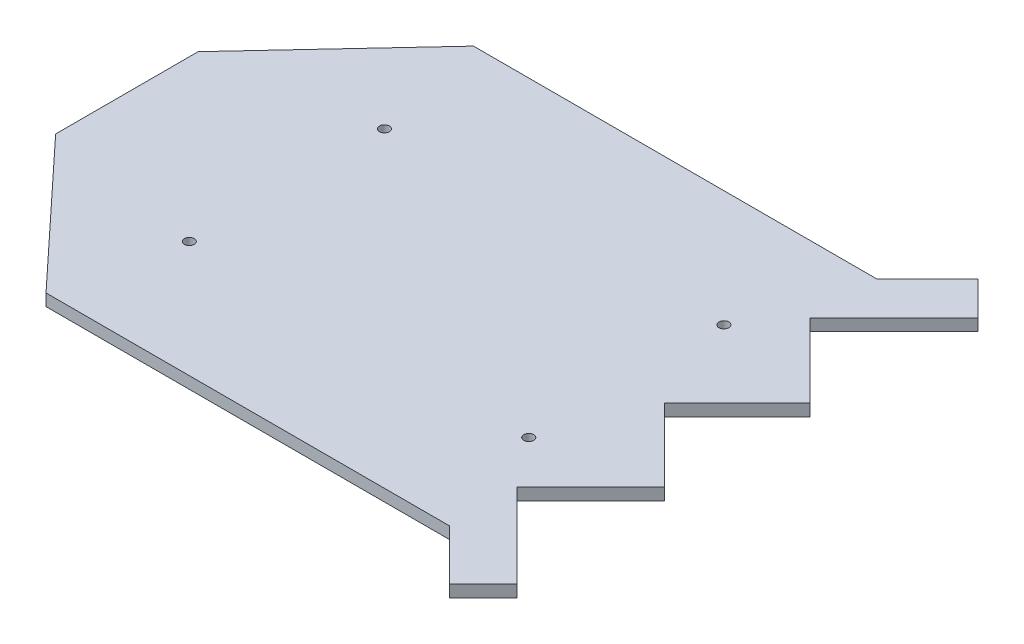
from build123d import *

# Parameters (mm, degrees)
BOSS_EXTRUDE1_DEPTH = 5
SKETCH2_R           = 2.1
CUT_EXTRUDE1_DEPTH  = 5
SKETCH5_R           = 2.1
CUT_EXTRUDE4_DEPTH  = 10


with BuildPart() as part:
    # Sketch1 → Boss-Extrude1 (new body)
    with BuildSketch(Plane(origin=(0, 0, 0), x_dir=(1, 0, 0), z_dir=(0, 1, 0))):
        Polygon((0, 30), (0, -30), (55.94, -90), (225.94, -90), (247.153203436, -111.213203436), (261.295339059, -97.071067812), (225.94, -61.715728753), (256.965728753, -30.69), (226.32179728, 0), (256.965728753, 30.69), (225.94, 61.715728753), (261.295339059, 97.071067812), (247.153203436, 111.213203436), (225.94, 90), (55.94, 90), align=None)
    extrude(amount=BOSS_EXTRUDE1_DEPTH)

    # Sketch2 → Cut-Extrude1 (cut)
    with BuildSketch(Plane(origin=(0, 5, 0), x_dir=(1, 0, 0), z_dir=(0, 1, 0))):
        with Locations(Location((210.29, 41.08, 0), (0, 0, 270))):
            Circle(SKETCH2_R)
        with Locations(Location((210.29, -41.08, 0), (0, 0, 90))):
            Circle(SKETCH2_R)
    extrude(amount=-CUT_EXTRUDE1_DEPTH, mode=Mode.SUBTRACT)

    # Sketch5 → Cut-Extrude4 (cut)
    with BuildSketch(Plane(origin=(0, 5, 0), x_dir=(1, 0, 0), z_dir=(0, 1, 0))):
        with Locations(Location((67.37, 41.08, 0), (0, 0, 270))):
            Circle(SKETCH5_R)
        with Locations(Location((67.36, -41.08, 0), (0, 0, 270))):
            Circle(SKETCH5_R)
    extrude(amount=-CUT_EXTRUDE4_DEPTH, mode=Mode.SUBTRACT)


solid = part.part
